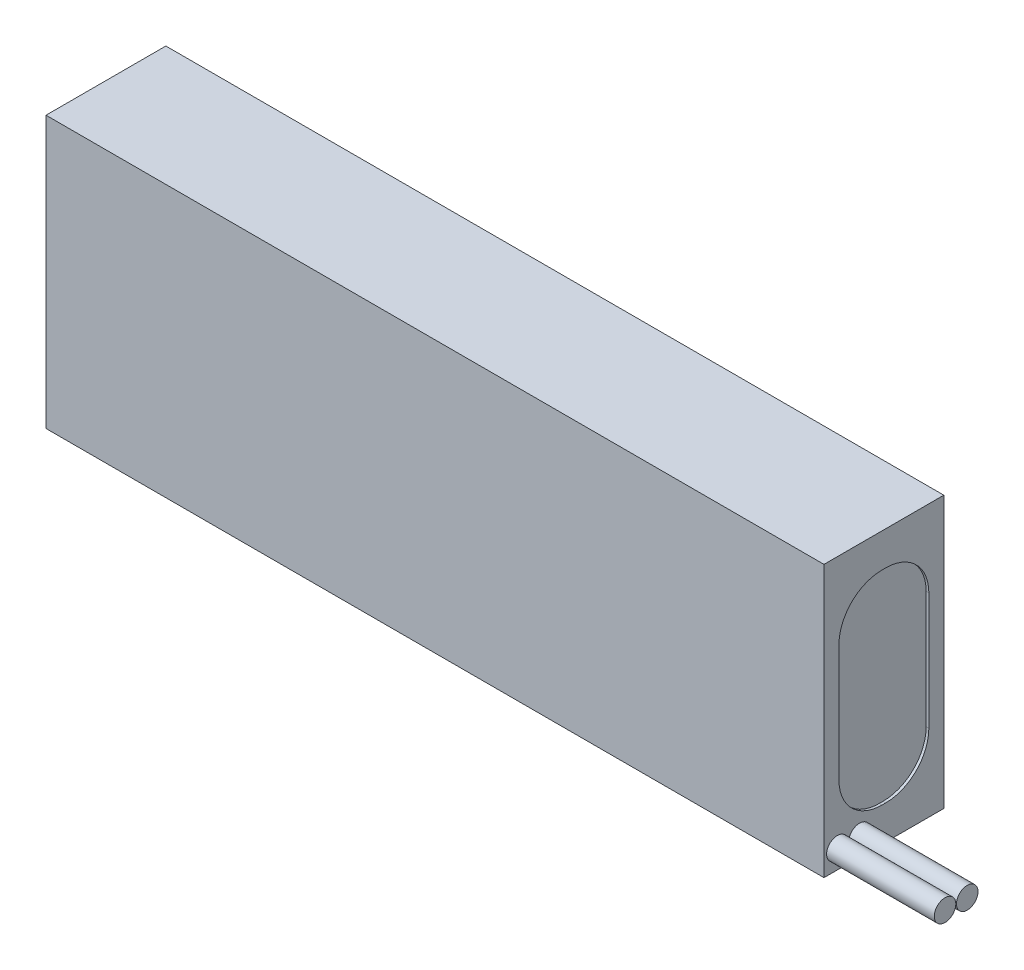
from build123d import *

# Parameters (mm, degrees)
SKETCH1_W           = 144.5
SKETCH1_H           = 50.4
BOSS_EXTRUDE1_DEPTH = 22.26
CUT_EXTRUDE1_DEPTH  = 0.5
CUT_EXTRUDE2_START  = -0.5
CUT_EXTRUDE2_DEPTH  = 0.5
SKETCH5_R           = 2
BOSS_EXTRUDE2_DEPTH = 20
SKETCH6_R           = 2
BOSS_EXTRUDE3_DEPTH = 20


with BuildPart() as part:
    # Sketch1 → Boss-Extrude1 (new body)
    with BuildSketch(Plane(origin=(0, 0, -15), x_dir=(-1, 0, 0), z_dir=(0, 0, -1))):
        with Locations((3.25, 3.2)):
            Rectangle(SKETCH1_W, SKETCH1_H)
    extrude(amount=-BOSS_EXTRUDE1_DEPTH)

    # Sketch2 → Cut-Extrude1 (cut)
    with BuildSketch(Plane(origin=(69, 0, 0), x_dir=(0, 0, -1), z_dir=(1, 0, 0))):
        with BuildLine():
            Line((-4.4775, 14.1), (-4.4775, -7.7))
            ThreePointArc((-4.4775, -7.7), (-2.134354249, -13.356854249), (3.5225, -15.7))
            Line((3.5225, -15.7), (4.2175, -15.7))
            ThreePointArc((4.2175, -15.7), (9.874354249, -13.356854249), (12.2175, -7.7))
            Line((12.2175, -7.7), (12.2175, 14.1))
            ThreePointArc((12.2175, 14.1), (9.874354249, 19.756854249), (4.2175, 22.1))
            Line((4.2175, 22.1), (3.5225, 22.1))
            ThreePointArc((3.5225, 22.1), (-2.134354249, 19.756854249), (-4.4775, 14.1))
        make_face()
    extrude(amount=-CUT_EXTRUDE1_DEPTH, mode=Mode.SUBTRACT)

    # Sketch3 → Cut-Extrude2 (cut)
    with BuildSketch(Plane.ZY.offset(75.5).offset(CUT_EXTRUDE2_START)):
        with BuildLine():
            Line((-3.5225, 22.1), (-4.2175, 22.1))
            ThreePointArc((-4.2175, 22.1), (-9.874354249, 19.756854249), (-12.2175, 14.1))
            Line((-12.2175, 14.1), (-12.2175, -7.7))
            ThreePointArc((-12.2175, -7.7), (-9.874354249, -13.356854249), (-4.2175, -15.7))
            Line((-4.2175, -15.7), (-3.5225, -15.7))
            ThreePointArc((-3.5225, -15.7), (2.134354249, -13.356854249), (4.4775, -7.7))
            Line((4.4775, -7.7), (4.4775, 14.1))
            ThreePointArc((4.4775, 14.1), (2.134354249, 19.756854249), (-3.5225, 22.1))
        make_face()
    extrude(amount=CUT_EXTRUDE2_DEPTH, mode=Mode.SUBTRACT)

    # Sketch5 → Boss-Extrude2 (add)
    with BuildSketch(Plane(origin=(69, 0, 0), x_dir=(0, 0, -1), z_dir=(1, 0, 0))):
        with Locations((-0.651385293, -18.534553966)):
            Circle(SKETCH5_R)
    extrude(amount=BOSS_EXTRUDE2_DEPTH)

    # Sketch6 → Boss-Extrude3 (add)
    with BuildSketch(Plane(origin=(69, 0, 0), x_dir=(0, 0, -1), z_dir=(1, 0, 0))):
        with Locations((-4.774830425, -18.459565293)):
            Circle(SKETCH6_R)
    extrude(amount=BOSS_EXTRUDE3_DEPTH)


solid = part.part
